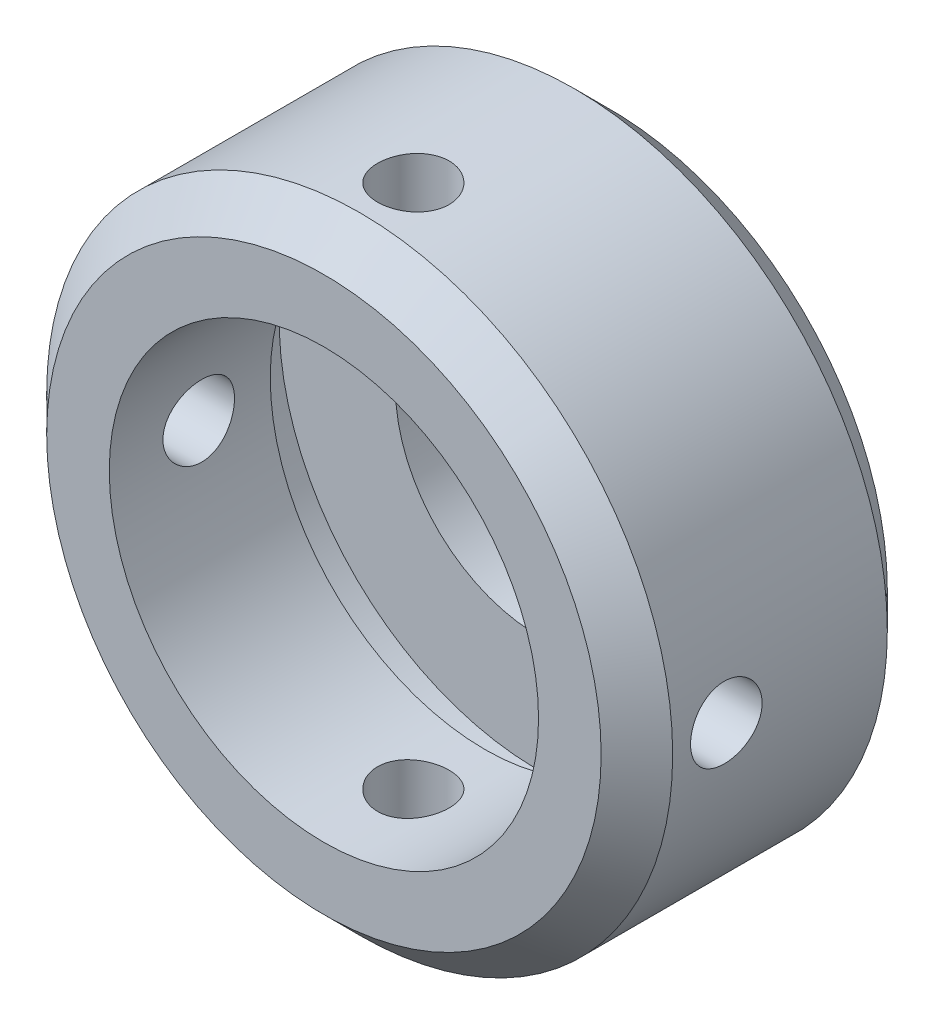
from build123d import *

# Parameters (mm, degrees)
SKETCH_1_R               = 17.5
EXTRUDE_1_DEPTH          = 16
HOLE_WIZARD_M27_1_D      = 24
HOLE_WIZARD_M27_1_DEPTH  = 9
HOLE_WIZARD_M27_1_TIP    = 6.92820323
SKETCH_4_R               = 17.5
EXTRUDE_2_DEPTH          = 4
SKETCH_5_W               = 3
SKETCH_5_H               = 10
SKETCH_6_R               = 2
CUT_EXTRUDE_1_DEPTH      = 30.470324057
PATTERN_CIRCULAR_1_COUNT = 4
SKETCH_7_R               = 8
CUT_EXTRUDE_2_DEPTH      = 30.47032423
CHAMFER_1_SIZE           = 2


with BuildPart() as part:
    # 草图1 → 凸台-拉伸1 (new body)
    with BuildSketch(Plane.XY):
        Circle(SKETCH_1_R)
    extrude(amount=EXTRUDE_1_DEPTH)

    # M27 螺纹孔1
    with Locations(Plane.XY.offset(16)):
        with Locations((0, 0)):
            Hole(HOLE_WIZARD_M27_1_D / 2, depth=HOLE_WIZARD_M27_1_DEPTH)
            with Locations((0, 0, -(HOLE_WIZARD_M27_1_DEPTH + HOLE_WIZARD_M27_1_TIP / 2))):  # 120° drill point
                Cone(0, HOLE_WIZARD_M27_1_D / 2, HOLE_WIZARD_M27_1_TIP, mode=Mode.SUBTRACT)

    # 草图4 → 凸台-拉伸2 (add)
    with BuildSketch(Plane(origin=(0, 0, 0), x_dir=(-1, 0, 0), z_dir=(0, 0, -1))):
        with Locations(Location((0, 0, 0), (0, 0, 180))):
            Circle(SKETCH_4_R)
    extrude_2 = extrude(amount=-EXTRUDE_2_DEPTH)

    # 草图5 → 切除-旋转1 (revolve, cut)
    with BuildSketch(Plane(origin=(0, 0, 0), x_dir=(0, 0, -1), z_dir=(1, 0, 0)), mode=Mode.PRIVATE) as cut_revolve_1_sk:
        with Locations((-5.5, 9.5)):
            Rectangle(SKETCH_5_W, SKETCH_5_H)
    revolve(cut_revolve_1_sk.sketch.rotate(Axis((0, 0, 16), (0, 0, -1)), 90), axis=Axis((0, 0, 16), (0, 0, -1)), mode=Mode.SUBTRACT)

    # 草图6 → 切除-拉伸1 (cut, through all)
    with BuildSketch(Plane(origin=(0, 0, 0), x_dir=(0, 0, -1), z_dir=(1, 0, 0))):
        with Locations((-11, 0)):
            Circle(SKETCH_6_R)
    cut_extrude_1 = extrude(amount=-CUT_EXTRUDE_1_DEPTH, mode=Mode.SUBTRACT)

    # 阵列(圆周)1: 凸台-拉伸2, 切除-拉伸1 ×4 about axis
    pattern_circular_1_axis = Axis((0, 0, 16), (0, 0, -1))
    add([extrude_2.rotate(pattern_circular_1_axis, i * 360 / PATTERN_CIRCULAR_1_COUNT) for i in range(1, PATTERN_CIRCULAR_1_COUNT)])
    add([cut_extrude_1.rotate(pattern_circular_1_axis, i * 360 / PATTERN_CIRCULAR_1_COUNT) for i in range(1, PATTERN_CIRCULAR_1_COUNT)], mode=Mode.SUBTRACT)

    # 草图7 → 切除-拉伸2 (cut, through all)
    with BuildSketch(Plane(origin=(0, 0, 0), x_dir=(-1, 0, 0), z_dir=(0, 0, -1))):
        Circle(SKETCH_7_R)
    extrude(amount=-CUT_EXTRUDE_2_DEPTH, mode=Mode.SUBTRACT)

    # 倒角1
    chamfer_1_edges = [part.edges().sort_by_distance(p)[0] for p in [
        (-17.5, 0, 0),
        (-17.5, 0, 16),
    ]]
    chamfer(chamfer_1_edges, length=CHAMFER_1_SIZE)


solid = part.part
